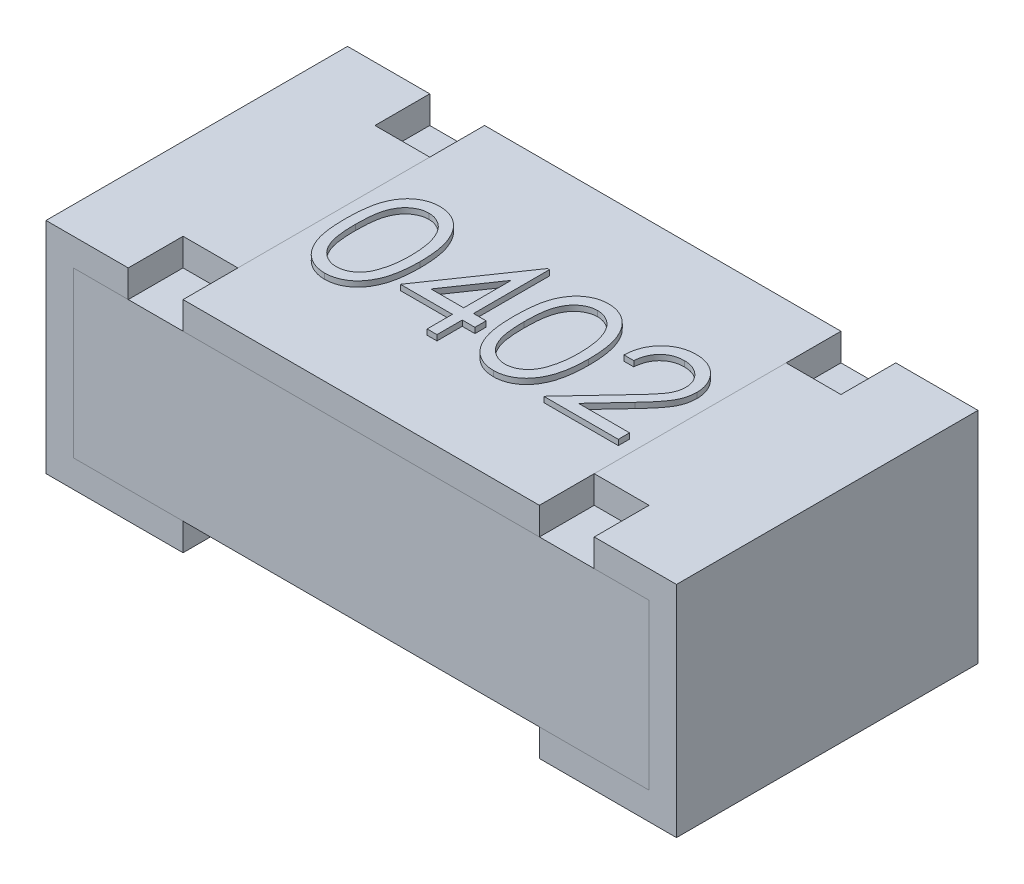
from build123d import *

# Parameters (mm, degrees)
CROQUIS1_W          = 1.05
CROQUIS1_H          = 0.55
EXTRUIR1_DEPTH      = 0.35
CROQUIS2_W          = 1.05
CROQUIS2_H          = 0.05
EXTRUIR2_DEPTH      = 1.837033452
CROQUIS4_W          = 0.55
CROQUIS4_H          = 0.05
EXTRUIR3_DEPTH      = 0.65
CROQUIS5_W          = 0.1
CROQUIS5_H          = 0.1
EXTRUIR4_DEPTH      = 0.05
BOSS_EXTRUDE1_DEPTH = 0.01


with BuildPart() as part:
    # Croquis1 → Extruir1 (new body)
    with BuildSketch(Plane(origin=(0, 0, 0), x_dir=(1, 0, 0), z_dir=(0, 1, 0))):
        Rectangle(CROQUIS1_W, CROQUIS1_H)
    extrude(amount=EXTRUIR1_DEPTH)

    # Croquis2 → Extruir2 (cut, through all)
    with BuildSketch(Plane.XY.offset(0.275)):
        with Locations((0, 0.025)):
            Rectangle(CROQUIS2_W, CROQUIS2_H)
    extrude(amount=-EXTRUIR2_DEPTH, mode=Mode.SUBTRACT)


with BuildPart() as body_2:
    # Barrer1: sweep along a path in Croquis3
    with BuildLine(Plane.XY.offset(0.275)) as barrer1_path:
        Line((-0.325, 0.4), (-0.575, 0.4))
        Line((-0.575, 0.4), (-0.575, 0))
        Line((-0.575, 0), (-0.325, 0))
    # Croquis3D1 → Barrer1 (sweep)
    with BuildSketch(Plane(origin=(-0.325, 0.4, 0.275), x_dir=(0, -0.09053574604251856, -0.995893206467704), z_dir=(1, 0, 0))):
        Polygon((0, 0), (0.547741264, 0.04979466), (0.552268051, 0), (0.004526787, -0.04979466), align=None)
    sweep(path=barrer1_path.line, transition=Transition.RIGHT)


with BuildPart() as body_3:
    # Simetría1: mirrored copy
    add(body_2.part.mirror(Plane(origin=(0, 0.35, 0.275), x_dir=(0, 0, 1), z_dir=(1, 0, 0))))


with BuildPart() as body_4:
    # Croquis4 → Extruir3 (new body)
    with BuildSketch(Plane(origin=(-0.325, 0, 0), x_dir=(0, 0, -1), z_dir=(1, 0, 0))):
        with Locations((0, 0.375)):
            Rectangle(CROQUIS4_W, CROQUIS4_H)
    extrude(amount=EXTRUIR3_DEPTH)

    # Sketch1 → Boss-Extrude1 (add)
    # profile 1 of 4: a face of its own
    with BuildSketch(Plane(origin=(0, 0.4, 0), x_dir=(1, 0, 0), z_dir=(0, 1, 0))):
        with BuildLine():
            add(Edge.make_bspline(
                [(-0.294744368, -0.008868831), (-0.294725624, -0.005663266), (-0.294689214, 0.00056359), (-0.294284161, 0.009636999), (-0.293611284, 0.018149015), (-0.292689149, 0.026100047), (-0.291566978, 0.033492148), (-0.290068951, 0.040305563), (-0.288365362, 0.046571826), (-0.286390936, 0.052311372), (-0.284163063, 0.057601526), (-0.281738248, 0.062540109), (-0.27902026, 0.067119648), (-0.276164436, 0.071413236), (-0.273055175, 0.07535059), (-0.269780958, 0.078987314), (-0.266213994, 0.082239357), (-0.262475536, 0.085202002), (-0.258531738, 0.087799115), (-0.254495014, 0.0900867), (-0.25033758, 0.092040978), (-0.246048084, 0.093577575), (-0.24166508, 0.094846766), (-0.237173248, 0.095714706), (-0.23256517, 0.096260815), (-0.229454802, 0.096313024), (-0.227877381, 0.096339503)],
                knots=[0, 0, 0, 0, 1.646270934, 3.197905019, 4.663502075, 6.030701355, 7.308322542, 8.50163776, 9.611534131, 10.641858119, 11.616356847, 12.558055219, 13.465016945, 14.349605745, 15.204443733, 16.039544428, 16.859896111, 17.680448484, 18.487036065, 19.28249412, 20.06191084, 20.843045899, 21.620316918, 22.403196591, 23.190181807, 24, 24, 24, 24], degree=3))
            add(Edge.make_bspline(
                [(-0.227877381, 0.096339503), (-0.226286782, 0.096311627), (-0.223123581, 0.096256192), (-0.218446988, 0.095723396), (-0.213878435, 0.094839332), (-0.209437399, 0.093586704), (-0.205087399, 0.092032666), (-0.200862462, 0.090084831), (-0.196736343, 0.087817467), (-0.192774612, 0.085153245), (-0.188933777, 0.082182829), (-0.185308179, 0.078824963), (-0.181897489, 0.07511355), (-0.1786589, 0.071088301), (-0.175684294, 0.06667201), (-0.172851527, 0.06194149), (-0.170315982, 0.056814012), (-0.167874, 0.051375128), (-0.165766172, 0.045474347), (-0.163865244, 0.039144932), (-0.162329303, 0.032312122), (-0.161049916, 0.025011765), (-0.160058779, 0.017217051), (-0.159336914, 0.00894469), (-0.158955595, 0.00018924), (-0.158883783, -0.005796923), (-0.158846932, -0.008868831)],
                knots=[0, 0, 0, 0, 0.810914788, 1.612654377, 2.396697861, 3.181598691, 3.963628158, 4.749916497, 5.551656086, 6.361998678, 7.18212741, 8.025565596, 8.878627764, 9.750805457, 10.657531673, 11.591944965, 12.560506719, 13.57287815, 14.630710178, 15.753379473, 16.941251878, 18.199788006, 19.531962791, 20.947069417, 22.433333509, 24, 24, 24, 24], degree=3))
            add(Edge.make_bspline(
                [(-0.158846932, -0.008868831), (-0.158884165, -0.01192734), (-0.158956713, -0.01788672), (-0.159332639, -0.026602776), (-0.160073132, -0.034831235), (-0.160999417, -0.042591833), (-0.16228233, -0.049852269), (-0.163859768, -0.056637666), (-0.165611215, -0.062977327), (-0.167773203, -0.068819316), (-0.170139529, -0.074245129), (-0.172714112, -0.079311823), (-0.175472388, -0.084064183), (-0.178477459, -0.088464168), (-0.181680511, -0.092542948), (-0.185150099, -0.096228527), (-0.188788418, -0.099609708), (-0.192640556, -0.102618373), (-0.196664073, -0.10525179), (-0.20077602, -0.107606867), (-0.205049357, -0.109505878), (-0.20938724, -0.111136452), (-0.213851718, -0.112382192), (-0.218437226, -0.113243555), (-0.223120439, -0.113847661), (-0.226286243, -0.113893746), (-0.227877381, -0.113916908)],
                knots=[0, 0, 0, 0, 1.561518951, 3.042555995, 4.452378317, 5.7783523, 7.031515105, 8.214008947, 9.334062868, 10.386615937, 11.391082383, 12.354592575, 13.286541444, 14.194233754, 15.072674879, 15.931287219, 16.775624067, 17.606195743, 18.42308326, 19.229000347, 20.022332153, 20.807536673, 21.593273796, 22.3848459, 23.188221202, 24, 24, 24, 24], degree=3))
            add(Edge.make_bspline(
                [(-0.227877381, -0.113916908), (-0.229454758, -0.113890259), (-0.23256504, -0.113837712), (-0.23717375, -0.113294071), (-0.241647032, -0.112420042), (-0.246006961, -0.111196236), (-0.250275905, -0.109698245), (-0.254395693, -0.107746606), (-0.258412132, -0.105498945), (-0.262314506, -0.102939207), (-0.266029487, -0.100006539), (-0.269577979, -0.096762866), (-0.272870837, -0.093127242), (-0.275935642, -0.089157075), (-0.278848448, -0.08488889), (-0.28152784, -0.080264411), (-0.284006175, -0.075301976), (-0.286271517, -0.069969524), (-0.288280012, -0.064189243), (-0.290054167, -0.057895004), (-0.291454976, -0.051031253), (-0.292654002, -0.043653118), (-0.29362111, -0.035728894), (-0.294281357, -0.027254278), (-0.294689432, -0.018234551), (-0.294725722, -0.012047707), (-0.294744368, -0.008868831)],
                knots=[0, 0, 0, 0, 0.810891512, 1.598919785, 2.382837074, 3.152667961, 3.926044502, 4.706494248, 5.493654104, 6.291793342, 7.103789334, 7.925228297, 8.761435821, 9.622817696, 10.50288917, 11.416980706, 12.369136599, 13.353924996, 14.394355917, 15.514179734, 16.714354668, 17.994756427, 19.357759367, 20.818452758, 22.365282078, 24, 24, 24, 24], degree=3))
        make_face()
        with BuildLine():
            add(Edge.make_bspline(
                [(-0.27679565, -0.008788703), (-0.276788824, -0.011460057), (-0.276775577, -0.016644631), (-0.276429509, -0.024178531), (-0.275958067, -0.031205407), (-0.275349993, -0.037734181), (-0.274446967, -0.043742753), (-0.273435151, -0.049272449), (-0.272203831, -0.054294006), (-0.270746973, -0.058841881), (-0.269087596, -0.062993256), (-0.267275832, -0.066856182), (-0.265329505, -0.070476293), (-0.263151268, -0.073821071), (-0.260778979, -0.076901423), (-0.258266221, -0.079771871), (-0.255519216, -0.082331698), (-0.251719003, -0.085401804), (-0.246702061, -0.088574326), (-0.240380892, -0.09133696), (-0.233885552, -0.0930731), (-0.229476909, -0.093293886), (-0.227276419, -0.093404087)],
                knots=[0, 0, 0, 0, 1.459021318, 2.831673884, 4.118529203, 5.306027144, 6.411944654, 7.436330062, 8.375795394, 9.233974572, 10.042671642, 10.816086306, 11.563610507, 12.285937304, 12.993564865, 13.685989202, 14.367179055, 15.041617293, 16.353048772, 17.594441528, 18.799311195, 20, 20, 20, 20], degree=3))
            add(Edge.make_bspline(
                [(-0.227276419, -0.093404087), (-0.225061695, -0.093312785), (-0.220636819, -0.09313037), (-0.214172031, -0.091370443), (-0.207896016, -0.08871504), (-0.202977619, -0.085575183), (-0.199235759, -0.082584993), (-0.196554788, -0.080035584), (-0.1940941, -0.077180963), (-0.191760267, -0.074101003), (-0.189619749, -0.070736861), (-0.187673284, -0.067104714), (-0.185897092, -0.063194476), (-0.184885147, -0.060464776), (-0.184367765, -0.059069151)],
                knots=[0, 0, 0, 0, 1.353760809, 2.704726607, 4.075137775, 5.516104923, 6.260822281, 7.007110065, 7.778089737, 8.566572457, 9.372053459, 10.217411131, 11.088608312, 12, 12, 12, 12], degree=3))
            add(Edge.make_bspline(
                [(-0.184367765, -0.059069151), (-0.183764807, -0.057284595), (-0.182540543, -0.05366118), (-0.180962728, -0.0480404), (-0.179720133, -0.042143099), (-0.178602227, -0.036004521), (-0.177839195, -0.029579395), (-0.177225034, -0.022887602), (-0.176863281, -0.015924095), (-0.176818438, -0.011192953), (-0.17679565, -0.008788703)],
                knots=[0, 0, 0, 0, 0.884706709, 1.796334032, 2.740027952, 3.714592787, 4.726048262, 5.777819803, 6.87074269, 8, 8, 8, 8], degree=3))
            add(Edge.make_bspline(
                [(-0.17679565, -0.008788703), (-0.176827089, -0.006384841), (-0.176888591, -0.001682375), (-0.177123676, 0.005204378), (-0.177730738, 0.011745393), (-0.178404973, 0.017968849), (-0.1793991, 0.023840295), (-0.180470975, 0.029408884), (-0.181911044, 0.034605628), (-0.183449317, 0.03951189), (-0.185209911, 0.044071927), (-0.187147953, 0.048307001), (-0.189217768, 0.052237556), (-0.191465896, 0.05585281), (-0.193865649, 0.059168955), (-0.196480366, 0.062119504), (-0.19920633, 0.064795902), (-0.203024455, 0.067850906), (-0.208022986, 0.07096586), (-0.214242737, 0.073832475), (-0.220715345, 0.075478663), (-0.225090971, 0.075710759), (-0.227276419, 0.075826682)],
                knots=[0, 0, 0, 0, 1.31362396, 2.569729283, 3.763502607, 4.902122613, 5.988968491, 7.01645872, 7.998833611, 8.933434873, 9.825090667, 10.667526885, 11.477055099, 12.250526234, 12.991942729, 13.710640831, 14.402115721, 15.076753259, 16.378508321, 17.609869233, 18.806226677, 20, 20, 20, 20], degree=3))
            add(Edge.make_bspline(
                [(-0.227276419, 0.075826682), (-0.229488453, 0.075710599), (-0.23391655, 0.075478223), (-0.240456433, 0.073838608), (-0.246725254, 0.070980724), (-0.251710566, 0.067840589), (-0.255531354, 0.064849828), (-0.258221794, 0.062256316), (-0.260744432, 0.059419388), (-0.263068301, 0.056310707), (-0.265244831, 0.052969829), (-0.267243746, 0.049370471), (-0.269044737, 0.045494393), (-0.27070671, 0.041344882), (-0.272168012, 0.0367974), (-0.273373382, 0.031782028), (-0.274486927, 0.02626992), (-0.275275228, 0.020228806), (-0.275976015, 0.013698397), (-0.276426377, 0.006653979), (-0.276776735, -0.000892557), (-0.276789219, -0.006103938), (-0.27679565, -0.008788703)],
                knots=[0, 0, 0, 0, 1.207732386, 2.417664972, 3.655092373, 4.956220595, 5.625982001, 6.301752483, 6.994047911, 7.697131622, 8.419323945, 9.170223765, 9.943494443, 10.752040957, 11.610060368, 12.549350801, 13.567764191, 14.679664412, 15.874934091, 17.154273443, 18.533957287, 20, 20, 20, 20], degree=3))
        make_face(mode=Mode.SUBTRACT)
    # profile 2 of 4: a face of its own
    with BuildSketch(Plane(origin=(0, 0.4, 0), x_dir=(1, 0, 0), z_dir=(0, 1, 0))):
        Polygon((-0.031723534, 0.096339503), (-0.028077701, 0.096339503), (-0.028077701, -0.042122036), (-0.005000778, -0.042122036), (-0.005000778, -0.062634856), (-0.028077701, -0.062634856), (-0.028077701, -0.108788703), (-0.046026419, -0.108788703), (-0.046026419, -0.062634856), (-0.140898214, -0.062634856), align=None)
        Polygon((-0.046026419, -0.042122036), (-0.046026419, 0.044736938), (-0.105641804, -0.042122036), align=None, mode=Mode.SUBTRACT)
    # profile 3 of 4: a face of its own
    with BuildSketch(Plane(origin=(0, 0.4, 0), x_dir=(1, 0, 0), z_dir=(0, 1, 0))):
        with BuildLine():
            add(Edge.make_bspline(
                [(0.01294794, -0.008868831), (0.012966684, -0.005663266), (0.013003094, 0.00056359), (0.013408147, 0.009636999), (0.014081023, 0.018149015), (0.015003159, 0.026100047), (0.016125329, 0.033492148), (0.017623357, 0.040305563), (0.019326946, 0.046571826), (0.021301371, 0.052311372), (0.023529245, 0.057601526), (0.02595406, 0.062540109), (0.028672048, 0.067119648), (0.031527872, 0.071413236), (0.034637133, 0.07535059), (0.03791135, 0.078987314), (0.041478314, 0.082239357), (0.045216772, 0.085202002), (0.04916057, 0.087799115), (0.053197293, 0.0900867), (0.057354728, 0.092040978), (0.061644224, 0.093577575), (0.066027227, 0.094846766), (0.07051906, 0.095714706), (0.075127138, 0.096260815), (0.078237505, 0.096313024), (0.079814927, 0.096339503)],
                knots=[0, 0, 0, 0, 1.646270934, 3.197905019, 4.663502075, 6.030701355, 7.308322542, 8.50163776, 9.611534131, 10.641858119, 11.616356847, 12.558055219, 13.465016945, 14.349605745, 15.204443733, 16.039544428, 16.859896111, 17.680448484, 18.487036065, 19.28249412, 20.06191084, 20.843045899, 21.620316918, 22.403196591, 23.190181807, 24, 24, 24, 24], degree=3))
            add(Edge.make_bspline(
                [(0.079814927, 0.096339503), (0.081405526, 0.096311627), (0.084568726, 0.096256192), (0.089245319, 0.095723396), (0.093813873, 0.094839332), (0.098254909, 0.093586704), (0.102604908, 0.092032666), (0.106829846, 0.090084831), (0.110955965, 0.087817467), (0.114917696, 0.085153245), (0.118758531, 0.082182829), (0.122384129, 0.078824963), (0.125794819, 0.07511355), (0.129033408, 0.071088301), (0.132008014, 0.06667201), (0.134840781, 0.06194149), (0.137376326, 0.056814012), (0.139818308, 0.051375128), (0.141926135, 0.045474347), (0.143827064, 0.039144932), (0.145363005, 0.032312122), (0.146642392, 0.025011765), (0.147633529, 0.017217051), (0.148355394, 0.00894469), (0.148736713, 0.00018924), (0.148808525, -0.005796923), (0.148845376, -0.008868831)],
                knots=[0, 0, 0, 0, 0.810914788, 1.612654377, 2.396697861, 3.181598691, 3.963628158, 4.749916497, 5.551656086, 6.361998678, 7.18212741, 8.025565596, 8.878627764, 9.750805457, 10.657531673, 11.591944965, 12.560506719, 13.57287815, 14.630710178, 15.753379473, 16.941251878, 18.199788006, 19.531962791, 20.947069417, 22.433333509, 24, 24, 24, 24], degree=3))
            add(Edge.make_bspline(
                [(0.148845376, -0.008868831), (0.148808142, -0.01192734), (0.148735595, -0.01788672), (0.148359669, -0.026602776), (0.147619175, -0.034831235), (0.14669289, -0.042591833), (0.145409978, -0.049852269), (0.14383254, -0.056637666), (0.142081093, -0.062977327), (0.139919105, -0.068819316), (0.137552779, -0.074245129), (0.134978196, -0.079311823), (0.13221992, -0.084064183), (0.129214849, -0.088464168), (0.126011797, -0.092542948), (0.122542209, -0.096228527), (0.11890389, -0.099609708), (0.115051752, -0.102618373), (0.111028234, -0.10525179), (0.106916287, -0.107606867), (0.102642951, -0.109505878), (0.098305068, -0.111136452), (0.09384059, -0.112382192), (0.089255082, -0.113243555), (0.084571868, -0.113847661), (0.081406065, -0.113893746), (0.079814927, -0.113916908)],
                knots=[0, 0, 0, 0, 1.561518951, 3.042555995, 4.452378317, 5.7783523, 7.031515105, 8.214008947, 9.334062868, 10.386615937, 11.391082383, 12.354592575, 13.286541444, 14.194233754, 15.072674879, 15.931287219, 16.775624067, 17.606195743, 18.42308326, 19.229000347, 20.022332153, 20.807536673, 21.593273796, 22.3848459, 23.188221202, 24, 24, 24, 24], degree=3))
            add(Edge.make_bspline(
                [(0.079814927, -0.113916908), (0.078237549, -0.113890259), (0.075127268, -0.113837712), (0.070518558, -0.113294071), (0.066045275, -0.112420042), (0.061685346, -0.111196236), (0.057416403, -0.109698245), (0.053296615, -0.107746606), (0.049280176, -0.105498945), (0.045377801, -0.102939207), (0.041662821, -0.100006539), (0.038114329, -0.096762866), (0.034821471, -0.093127242), (0.031756665, -0.089157075), (0.02884386, -0.08488889), (0.026164467, -0.080264411), (0.023686133, -0.075301976), (0.021420791, -0.069969524), (0.019412296, -0.064189243), (0.017638141, -0.057895004), (0.016237332, -0.051031253), (0.015038306, -0.043653118), (0.014071198, -0.035728894), (0.013410951, -0.027254278), (0.013002876, -0.018234551), (0.012966586, -0.012047707), (0.01294794, -0.008868831)],
                knots=[0, 0, 0, 0, 0.810891512, 1.598919785, 2.382837074, 3.152667961, 3.926044502, 4.706494248, 5.493654104, 6.291793342, 7.103789334, 7.925228297, 8.761435821, 9.622817696, 10.50288917, 11.416980706, 12.369136599, 13.353924996, 14.394355917, 15.514179734, 16.714354668, 17.994756427, 19.357759367, 20.818452758, 22.365282078, 24, 24, 24, 24], degree=3))
        make_face()
        with BuildLine():
            add(Edge.make_bspline(
                [(0.030896658, -0.008788703), (0.030903483, -0.011460057), (0.030916731, -0.016644631), (0.031262799, -0.024178531), (0.031734241, -0.031205407), (0.032342315, -0.037734181), (0.033245341, -0.043742753), (0.034257157, -0.049272449), (0.035488477, -0.054294006), (0.036945335, -0.058841881), (0.038604712, -0.062993256), (0.040416475, -0.066856182), (0.042362802, -0.070476293), (0.04454104, -0.073821071), (0.046913329, -0.076901423), (0.049426087, -0.079771871), (0.052173091, -0.082331698), (0.055973305, -0.085401804), (0.060990247, -0.088574326), (0.067311415, -0.09133696), (0.073806756, -0.0930731), (0.078215398, -0.093293886), (0.080415889, -0.093404087)],
                knots=[0, 0, 0, 0, 1.459021318, 2.831673884, 4.118529203, 5.306027144, 6.411944654, 7.436330062, 8.375795394, 9.233974572, 10.042671642, 10.816086306, 11.563610507, 12.285937304, 12.993564865, 13.685989202, 14.367179055, 15.041617293, 16.353048772, 17.594441528, 18.799311195, 20, 20, 20, 20], degree=3))
            add(Edge.make_bspline(
                [(0.080415889, -0.093404087), (0.082630613, -0.093312785), (0.087055488, -0.09313037), (0.093520277, -0.091370443), (0.099796292, -0.08871504), (0.104714689, -0.085575183), (0.108456548, -0.082584993), (0.111137519, -0.080035584), (0.113598208, -0.077180963), (0.115932041, -0.074101003), (0.118072559, -0.070736861), (0.120019024, -0.067104714), (0.121795215, -0.063194476), (0.122807161, -0.060464776), (0.123324543, -0.059069151)],
                knots=[0, 0, 0, 0, 1.353760809, 2.704726607, 4.075137775, 5.516104923, 6.260822281, 7.007110065, 7.778089737, 8.566572457, 9.372053459, 10.217411131, 11.088608312, 12, 12, 12, 12], degree=3))
            add(Edge.make_bspline(
                [(0.123324543, -0.059069151), (0.123927501, -0.057284595), (0.125151764, -0.05366118), (0.12672958, -0.0480404), (0.127972174, -0.042143099), (0.129090081, -0.036004521), (0.129853113, -0.029579395), (0.130467273, -0.022887602), (0.130829027, -0.015924095), (0.13087387, -0.011192953), (0.130896658, -0.008788703)],
                knots=[0, 0, 0, 0, 0.884706709, 1.796334032, 2.740027952, 3.714592787, 4.726048262, 5.777819803, 6.87074269, 8, 8, 8, 8], degree=3))
            add(Edge.make_bspline(
                [(0.130896658, -0.008788703), (0.130865219, -0.006384841), (0.130803716, -0.001682375), (0.130568631, 0.005204378), (0.12996157, 0.011745393), (0.129287335, 0.017968849), (0.128293208, 0.023840295), (0.127221333, 0.029408884), (0.125781264, 0.034605628), (0.124242991, 0.03951189), (0.122482397, 0.044071927), (0.120544355, 0.048307001), (0.11847454, 0.052237556), (0.116226412, 0.05585281), (0.113826659, 0.059168955), (0.111211942, 0.062119504), (0.108485978, 0.064795902), (0.104667853, 0.067850906), (0.099669322, 0.07096586), (0.09344957, 0.073832475), (0.086976962, 0.075478663), (0.082601336, 0.075710759), (0.080415889, 0.075826682)],
                knots=[0, 0, 0, 0, 1.31362396, 2.569729283, 3.763502607, 4.902122613, 5.988968491, 7.01645872, 7.998833611, 8.933434873, 9.825090667, 10.667526885, 11.477055099, 12.250526234, 12.991942729, 13.710640831, 14.402115721, 15.076753259, 16.378508321, 17.609869233, 18.806226677, 20, 20, 20, 20], degree=3))
            add(Edge.make_bspline(
                [(0.080415889, 0.075826682), (0.078203855, 0.075710599), (0.073775757, 0.075478223), (0.067235874, 0.073838608), (0.060967054, 0.070980724), (0.055981741, 0.067840589), (0.052160954, 0.064849828), (0.049470514, 0.062256316), (0.046947876, 0.059419388), (0.044624007, 0.056310707), (0.042447476, 0.052969829), (0.040448561, 0.049370471), (0.038647571, 0.045494393), (0.036985598, 0.041344882), (0.035524296, 0.0367974), (0.034318926, 0.031782028), (0.03320538, 0.02626992), (0.032417079, 0.020228806), (0.031716293, 0.013698397), (0.03126593, 0.006653979), (0.030915573, -0.000892557), (0.030903089, -0.006103938), (0.030896658, -0.008788703)],
                knots=[0, 0, 0, 0, 1.207732386, 2.417664972, 3.655092373, 4.956220595, 5.625982001, 6.301752483, 6.994047911, 7.697131622, 8.419323945, 9.170223765, 9.943494443, 10.752040957, 11.610060368, 12.549350801, 13.567764191, 14.679664412, 15.874934091, 17.154273443, 18.533957287, 20, 20, 20, 20], degree=3))
        make_face(mode=Mode.SUBTRACT)
    # profile 4 of 4: a face of its own
    with BuildSketch(Plane(origin=(0, 0.4, 0), x_dir=(1, 0, 0), z_dir=(0, 1, 0))):
        with BuildLine():
            Line((0.192435119, 0.029672836), (0.174486402, 0.029672836))
            add(Edge.make_bspline(
                [(0.174486402, 0.029672836), (0.174603382, 0.032054029), (0.174833128, 0.03673063), (0.17590903, 0.043549139), (0.177448509, 0.050066556), (0.179625163, 0.056230551), (0.182328379, 0.062095626), (0.185570095, 0.067638484), (0.189409743, 0.072837981), (0.193764414, 0.077645914), (0.19849405, 0.082056633), (0.203597247, 0.085865504), (0.20895982, 0.089083656), (0.2145655, 0.091774013), (0.220477532, 0.093793433), (0.226642267, 0.095291812), (0.233086789, 0.096193318), (0.237477647, 0.09629022), (0.23971076, 0.096339503)],
                knots=[0, 0, 0, 0, 1.10065271, 2.161652631, 3.183658789, 4.190468796, 5.17591951, 6.163126047, 7.15150782, 8.156236427, 9.156009102, 10.134482811, 11.092018607, 12.041330605, 13.001268258, 13.972401359, 14.968799086, 16, 16, 16, 16], degree=3))
            add(Edge.make_bspline(
                [(0.23971076, 0.096339503), (0.241903793, 0.096288162), (0.246213024, 0.09618728), (0.252502282, 0.095320936), (0.258489556, 0.093964045), (0.264163143, 0.092060307), (0.269477775, 0.089501196), (0.274473378, 0.086427051), (0.279209424, 0.082871632), (0.283472669, 0.0786857), (0.287387416, 0.074216993), (0.290764688, 0.069446255), (0.293656869, 0.064518867), (0.296067593, 0.059397256), (0.29784223, 0.054033197), (0.299189556, 0.048504786), (0.299951123, 0.042754796), (0.300068004, 0.038862993), (0.300127427, 0.036884374)],
                knots=[0, 0, 0, 0, 1.111607364, 2.184268762, 3.212621178, 4.221274766, 5.211760367, 6.196651075, 7.1921475, 8.207485113, 9.220403448, 10.201281604, 11.166441695, 12.114753415, 13.065576456, 14.026450734, 14.996634279, 16, 16, 16, 16], degree=3))
            add(Edge.make_bspline(
                [(0.300127427, 0.036884374), (0.300030669, 0.034098784), (0.299838851, 0.028576486), (0.29819803, 0.020461351), (0.295635372, 0.01259887), (0.292549809, 0.006271024), (0.289437098, 0.001171967), (0.286632097, -0.003026245), (0.283348394, -0.007546557), (0.279538194, -0.012373834), (0.275280316, -0.017545885), (0.270536192, -0.023059588), (0.265271993, -0.028857975), (0.261577222, -0.032818295), (0.259662684, -0.034870433)],
                knots=[0, 0, 0, 0, 1.184426356, 2.348067706, 3.509069118, 4.696110526, 5.333549288, 6.050745305, 6.844228056, 7.710549037, 8.667450064, 9.695053472, 10.805634456, 12, 12, 12, 12], degree=3))
            Line((0.259662684, -0.034870433), (0.209622619, -0.088275882))
            Line((0.209622619, -0.088275882), (0.30269153, -0.088275882))
            Line((0.30269153, -0.088275882), (0.30269153, -0.108788703))
            Line((0.30269153, -0.108788703), (0.166794094, -0.108788703))
            Line((0.166794094, -0.108788703), (0.244358196, -0.026016267))
            add(Edge.make_bspline(
                [(0.244358196, -0.026016267), (0.246246647, -0.024044935), (0.249873974, -0.02025841), (0.255004407, -0.014730241), (0.259612349, -0.009601696), (0.263727629, -0.004882464), (0.267260972, -0.000503518), (0.270396528, 0.003393323), (0.272908848, 0.006979291), (0.275635442, 0.011135898), (0.278276241, 0.016210887), (0.280545518, 0.022412812), (0.281929224, 0.028797227), (0.282095215, 0.033111629), (0.282178709, 0.03528181)],
                knots=[0, 0, 0, 0, 1.329631726, 2.553950428, 3.673215718, 4.687767853, 5.603093632, 6.413772471, 7.123043292, 7.734684054, 8.834405432, 9.900288307, 10.943827018, 12, 12, 12, 12], degree=3))
            add(Edge.make_bspline(
                [(0.282178709, 0.03528181), (0.282142381, 0.036646462), (0.282070785, 0.039335927), (0.281438917, 0.043279114), (0.280484031, 0.047082817), (0.27911573, 0.050758738), (0.277309631, 0.054269918), (0.275111152, 0.057620632), (0.272574577, 0.060860001), (0.269640219, 0.063897332), (0.266416703, 0.066679115), (0.263011318, 0.069143349), (0.259408455, 0.071202727), (0.255623305, 0.072890926), (0.251666421, 0.074215234), (0.24753015, 0.075132867), (0.24322592, 0.075709009), (0.240286863, 0.075786962), (0.238789286, 0.075826682)],
                knots=[0, 0, 0, 0, 0.991446411, 1.95395049, 2.89581595, 3.838931463, 4.798493298, 5.75982156, 6.748411868, 7.785213223, 8.824556874, 9.840280684, 10.836137867, 11.835679398, 12.848801643, 13.863922112, 14.911575587, 16, 16, 16, 16], degree=3))
            add(Edge.make_bspline(
                [(0.238789286, 0.075826682), (0.237225239, 0.075785823), (0.234153707, 0.075705583), (0.229644048, 0.075144288), (0.225342004, 0.074175954), (0.221236752, 0.072851572), (0.217321347, 0.071168227), (0.213614831, 0.069071556), (0.210125523, 0.066569642), (0.206846864, 0.063733039), (0.203826065, 0.06057489), (0.201171958, 0.057054321), (0.198852872, 0.053235611), (0.196829487, 0.049129065), (0.195186305, 0.044697421), (0.193930696, 0.039956409), (0.192937162, 0.034926616), (0.192605246, 0.031453183), (0.192435119, 0.029672836)],
                knots=[0, 0, 0, 0, 1.031018746, 2.02475058, 2.990194455, 3.934040569, 4.864654155, 5.795059489, 6.735614925, 7.690564532, 8.649604399, 9.611025574, 10.590972636, 11.591080095, 12.624614302, 13.701020113, 14.821632451, 16, 16, 16, 16], degree=3))
        make_face()
    extrude(amount=BOSS_EXTRUDE1_DEPTH)


with BuildPart() as extruir4_tool:
    # Croquis5 → Extruir4 (new body)
    with BuildSketch(Plane(origin=(0, 0.4, 0), x_dir=(1, 0, 0), z_dir=(0, 1, 0))):
        with Locations((-0.375, -0.225)):
            Rectangle(CROQUIS5_W, CROQUIS5_H)
        with Locations((-0.375, 0.225)):
            Rectangle(CROQUIS5_W, CROQUIS5_H)
        with Locations((0.375, 0.225)):
            Rectangle(CROQUIS5_W, CROQUIS5_H)
        with Locations((0.375, -0.225)):
            Rectangle(CROQUIS5_W, CROQUIS5_H)
    extrude(amount=-EXTRUIR4_DEPTH)


with BuildPart() as body_2_1:
    add(body_2.part)

    # Extruir4: cut by extruir4_tool
    add(extruir4_tool.part, mode=Mode.SUBTRACT)


with BuildPart() as body_3_1:
    add(body_3.part)

    # Extruir4: cut by extruir4_tool
    add(extruir4_tool.part, mode=Mode.SUBTRACT)


solid = Compound([part.part, body_4.part, body_2_1.part, body_3_1.part])
